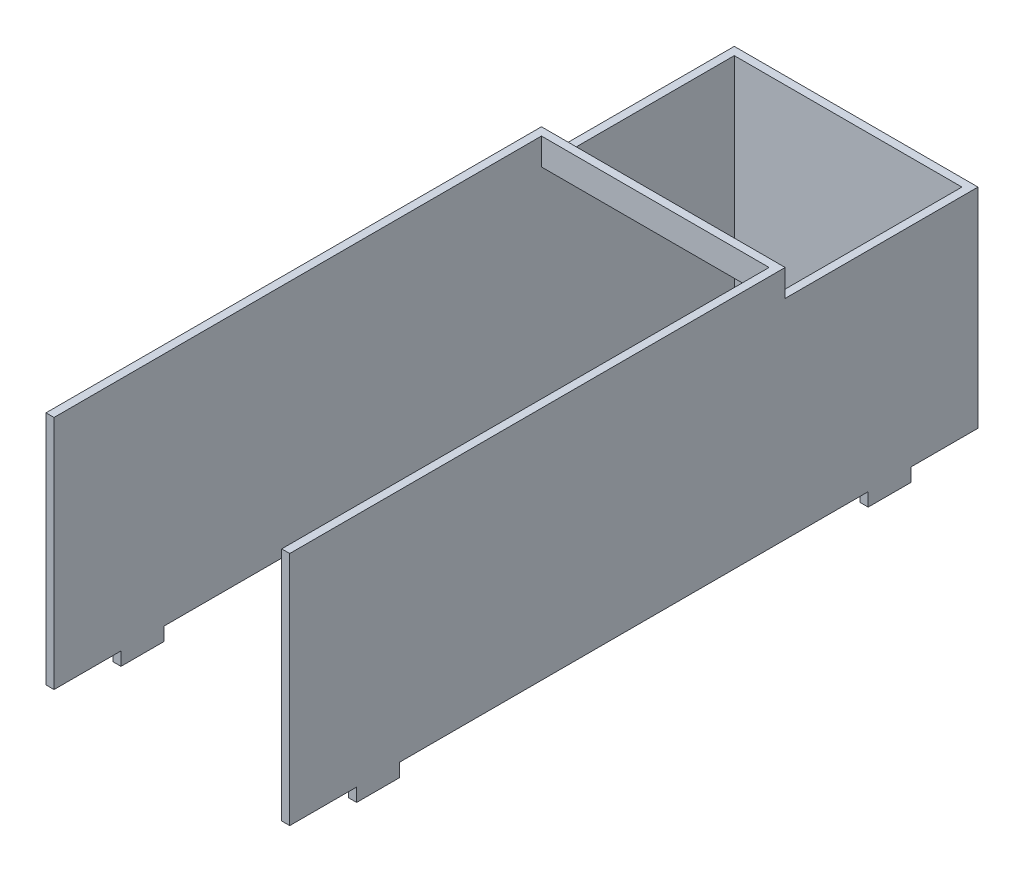
from build123d import *

# Parameters (mm, degrees)
BOSS_EXTRUDE1_DEPTH = 39
SKETCH2_W           = 1.5
SKETCH2_H           = 92.5
BOSS_EXTRUDE2_DEPTH = 5
SKETCH3_W           = 1.5
SKETCH3_H           = 8
BOSS_EXTRUDE3_DEPTH = 2.5
SKETCH4_W           = 45.5
SKETCH4_H           = 5
BOSS_EXTRUDE5_DEPTH = 1.5


with BuildPart() as part:
    # Sketch1 → Boss-Extrude1 (new body)
    with BuildSketch(Plane(origin=(0, 0, 0), x_dir=(1, 0, 0), z_dir=(0, 1, 0))):
        Polygon((22.75, 64.25), (22.75, -64.25), (21.25, -64.25), (21.25, 62.75), (-21.25, 62.75), (-21.25, -64.25), (-22.75, -64.25), (-22.75, 64.25), align=None)
    extrude(amount=BOSS_EXTRUDE1_DEPTH)

    # Sketch2 → Boss-Extrude2 (add)
    with BuildSketch(Plane(origin=(0, 39, 0), x_dir=(1, 0, 0), z_dir=(0, 1, 0))):
        with Locations((-22, -18)):
            Rectangle(SKETCH2_W, SKETCH2_H)
        with Locations((22, -18)):
            Rectangle(SKETCH2_W, SKETCH2_H)
    extrude(amount=BOSS_EXTRUDE2_DEPTH)

    # Sketch3 → Boss-Extrude3 (add)
    with BuildSketch(Plane.XZ):
        with Locations((22, -47.75)):
            Rectangle(SKETCH3_W, SKETCH3_H)
        with Locations((-22, -47.75)):
            Rectangle(SKETCH3_W, SKETCH3_H)
        with Locations((22, 47.75)):
            Rectangle(SKETCH3_W, SKETCH3_H)
        with Locations((-22, 47.75)):
            Rectangle(SKETCH3_W, SKETCH3_H)
    extrude(amount=BOSS_EXTRUDE3_DEPTH)

    # Sketch4 → Boss-Extrude5 (add)
    with BuildSketch(Plane(origin=(0, 0, -28.25), x_dir=(-1, 0, 0), z_dir=(0, 0, -1))):
        with Locations((0, 41.5)):
            Rectangle(SKETCH4_W, SKETCH4_H)
    extrude(amount=-BOSS_EXTRUDE5_DEPTH)


solid = part.part
